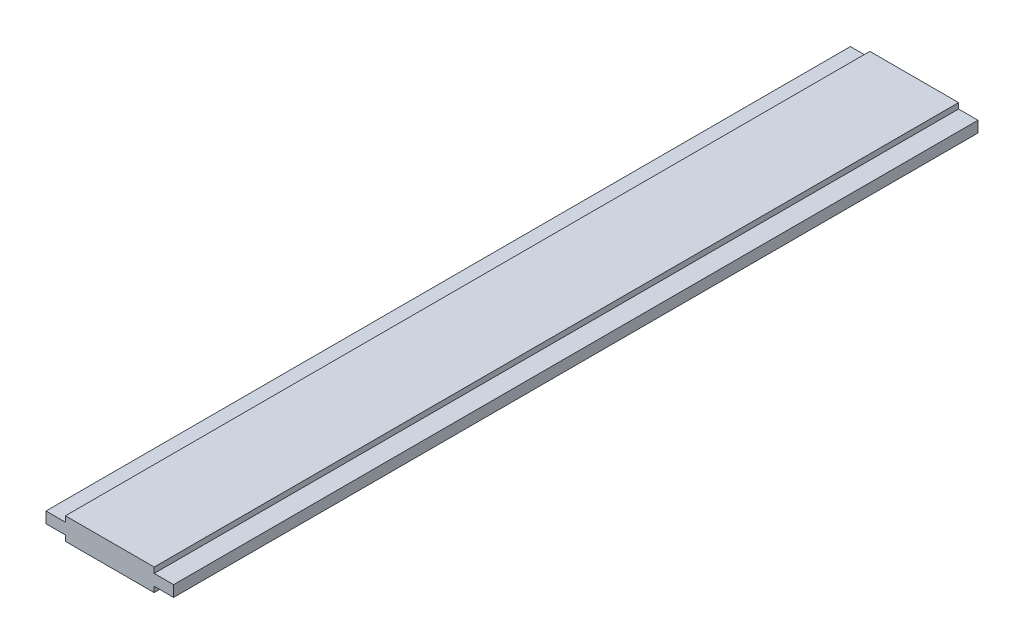
from build123d import *

# Parameters (mm, degrees)
BOSS_EXTRUDE1_DEPTH = 72.5


with BuildPart() as part:
    # Sketch1 → Boss-Extrude1 (new body)
    with BuildSketch(Plane.XY):
        Polygon((-4, 17.5), (-4, 17), (4, 17), (4, 17.5), (5.75, 17.5), (5.75, 18.5), (4, 18.5), (4, 19), (-4, 19), (-4, 18.5), (-5.75, 18.5), (-5.75, 17.5), align=None)
    extrude(amount=BOSS_EXTRUDE1_DEPTH)


solid = part.part
